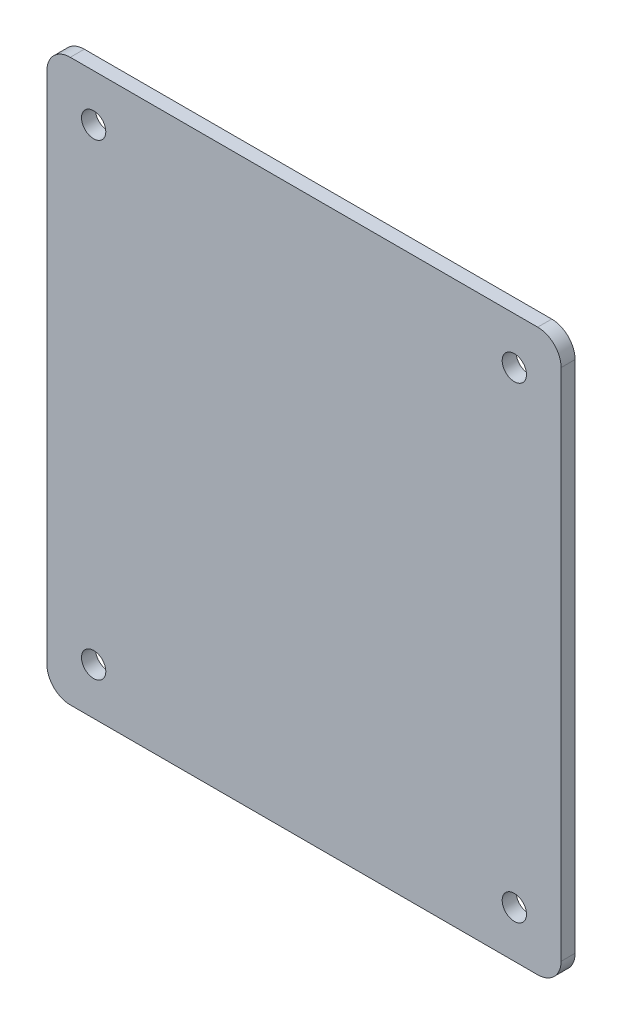
from build123d import *

# Parameters (mm, degrees)
SKETCH_2_W      = 110
SKETCH_2_H      = 120
SKETCH_2_R      = 2.6
EXTRUDE_1_DEPTH = 3
FILLET_1_R      = 5


with BuildPart() as part:
    # ｽｹｯﾁ2 → ﾎﾞｽ - 押し出し1 (new body)
    with BuildSketch(Plane.XY):
        with Locations((55, -60)):
            Rectangle(SKETCH_2_W, SKETCH_2_H)
        with Locations((10, -10)):
            Circle(SKETCH_2_R, mode=Mode.SUBTRACT)
        with Locations((100, -10)):
            Circle(SKETCH_2_R, mode=Mode.SUBTRACT)
        with Locations((10, -110)):
            Circle(SKETCH_2_R, mode=Mode.SUBTRACT)
        with Locations((100, -110)):
            Circle(SKETCH_2_R, mode=Mode.SUBTRACT)
    extrude(amount=EXTRUDE_1_DEPTH)

    # ﾌｨﾚｯﾄ1
    fillet_1_edges = [part.edges().sort_by_distance(p)[0] for p in [
        (0, 0, 1.5),
        (110, 0, 1.5),
        (110, -120, 1.5),
        (0, -120, 1.5),
    ]]
    fillet(fillet_1_edges, radius=FILLET_1_R)


solid = part.part
